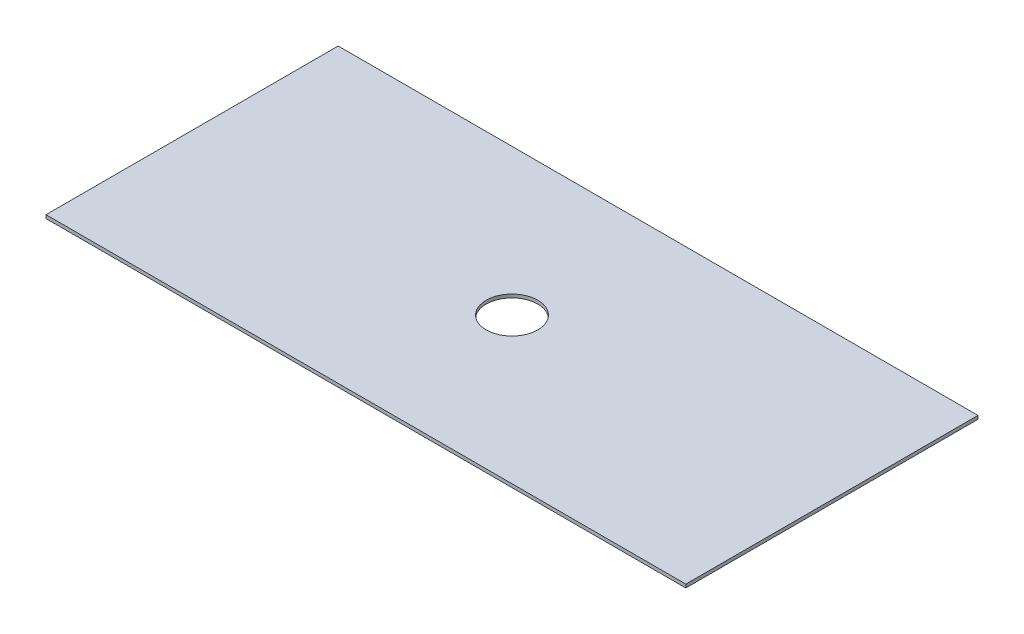
from build123d import *

# Parameters (mm, degrees)
SKETCH1_W           = 946
SKETCH1_H           = 432
BOSS_EXTRUDE1_DEPTH = 5
SKETCH2_R           = 38.1
CUT_EXTRUDE1_DEPTH  = 5


with BuildPart() as part:
    # Sketch1 → Boss-Extrude1 (new body)
    with BuildSketch(Plane(origin=(0, 0, 0), x_dir=(1, 0, 0), z_dir=(0, 1, 0))):
        Rectangle(SKETCH1_W, SKETCH1_H)
    extrude(amount=BOSS_EXTRUDE1_DEPTH)

    # Sketch2 → Cut-Extrude1 (cut)
    with BuildSketch(Plane(origin=(0, 0, 0), x_dir=(-1, 0, 0), z_dir=(0, -1, 0))):
        with Locations(Location((0, 0, 0), (0, 0, 90))):
            Circle(SKETCH2_R)
    extrude(amount=-CUT_EXTRUDE1_DEPTH, mode=Mode.SUBTRACT)


solid = part.part
